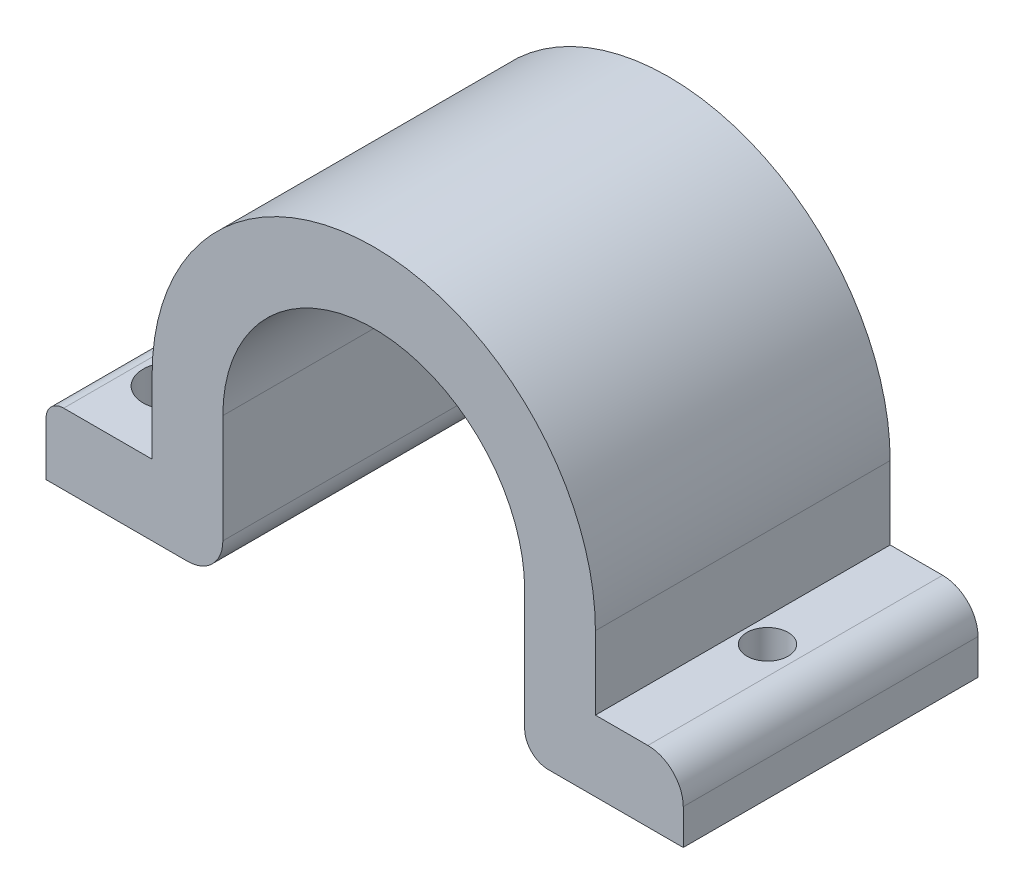
from build123d import *

# Parameters (mm, degrees)
BOSS_EXTRU_1_DEPTH      = 12.5
ESQUISSE2_R             = 2.5
ESQUISSE2_R_2           = 1.75
ENL_V_MAT_EXTRU_1_DEPTH = 10
CONG_4_R                = 3
CONG_5_R                = 1.5


with BuildPart() as part:
    # Esquisse1 → Boss.-Extru.1 (new, symmetric)
    with BuildSketch(Plane.XY):
        with BuildLine():
            Line((0.397051683, 57.076719782), (10.397051683, 57.076719782))
            ThreePointArc((10.397051683, 57.076719782), (12.518372027, 57.955399438), (13.397051683, 60.076719782))
            Line((13.397051683, 60.076719782), (13.397051683, 69.276719782))
            ThreePointArc((13.397051683, 69.276719782), (26.197051683, 82.076719782), (38.997051683, 69.276719782))
            Line((38.997051683, 69.276719782), (38.997051683, 59.076719782))
            ThreePointArc((38.997051683, 59.076719782), (39.582838121, 57.662506219), (40.997051683, 57.076719782))
            Line((40.997051683, 57.076719782), (49.420552909, 57.076719782))
            Line((49.420552909, 57.076719782), (52.447260314, 57.076719782))
            Line((52.447260314, 57.076719782), (52.447260314, 63.076719782))
            Line((52.447260314, 63.076719782), (49.420552909, 63.076719782))
            Line((49.420552909, 63.076719782), (44.997051683, 63.076719782))
            Line((44.997051683, 63.076719782), (44.997051683, 69.276719782))
            ThreePointArc((44.997051683, 69.276719782), (26.197051683, 88.076719782), (7.397051683, 69.276719782))
            Line((7.397051683, 69.276719782), (7.397051683, 63.076719782))
            Line((7.397051683, 63.076719782), (0.397051683, 63.076719782))
            Line((0.397051683, 63.076719782), (-1.602948317, 63.076719782))
            Line((-1.602948317, 63.076719782), (-1.602948317, 57.076719782))
            Line((-1.602948317, 57.076719782), (0.397051683, 57.076719782))
        make_face()
    extrude(amount=BOSS_EXTRU_1_DEPTH, both=True)

    # Esquisse2 → Enlèv. mat.-Extru.1 (cut)
    with BuildSketch(Plane(origin=(0, 63.076719782, 0), x_dir=(1, 0, 0), z_dir=(0, 1, 0))):
        with Locations(Location((2.897051683, 6.25, 0), (0, 0, 270))):
            Circle(ESQUISSE2_R)
        with Locations(Location((2.897051683, -6.25, 0), (0, 0, 180))):
            Circle(ESQUISSE2_R)
        with Locations(Location((47.0933932, 0, 0), (0, 0, 270))):
            Circle(ESQUISSE2_R_2)
    extrude(amount=-ENL_V_MAT_EXTRU_1_DEPTH, mode=Mode.SUBTRACT)

    # Congé4
    cong_4_edges = [part.edges().sort_by_distance(p)[0] for p in [
        (52.447260314, 63.076719782, 0),
    ]]
    fillet(cong_4_edges, radius=CONG_4_R)

    # Congé5
    cong_5_edges = [part.edges().sort_by_distance(p)[0] for p in [
        (-1.602948317, 63.076719782, 0),
    ]]
    fillet(cong_5_edges, radius=CONG_5_R)


solid = part.part
